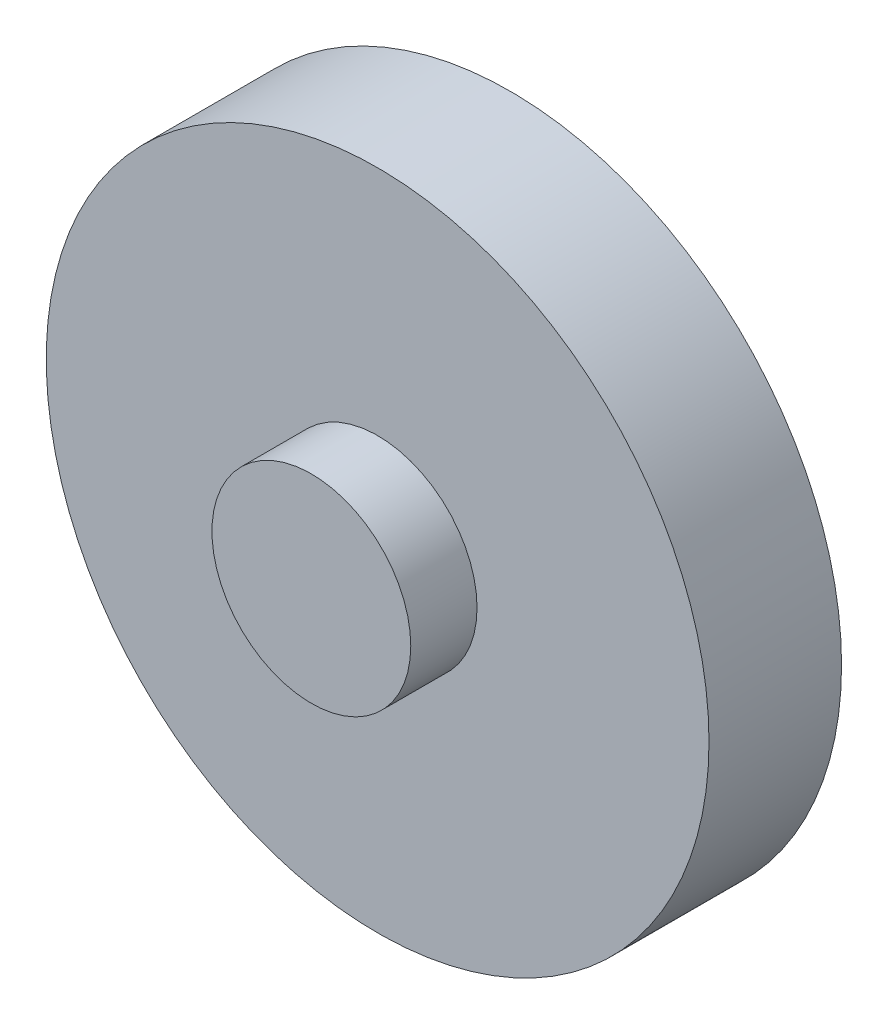
from build123d import *

# Parameters (mm, degrees)
SKETCH1_R           = 50
BOSS_EXTRUDE1_DEPTH = 20
SKETCH2_R           = 15
BOSS_EXTRUDE2_DEPTH = 10


with BuildPart() as part:
    # Sketch1 → Boss-Extrude1 (new body)
    with BuildSketch(Plane.XY):
        Circle(SKETCH1_R)
    extrude(amount=BOSS_EXTRUDE1_DEPTH)

    # Sketch2 → Boss-Extrude2 (add)
    with BuildSketch(Plane.XY.offset(20)):
        Circle(SKETCH2_R)
    extrude(amount=BOSS_EXTRUDE2_DEPTH)


solid = part.part
